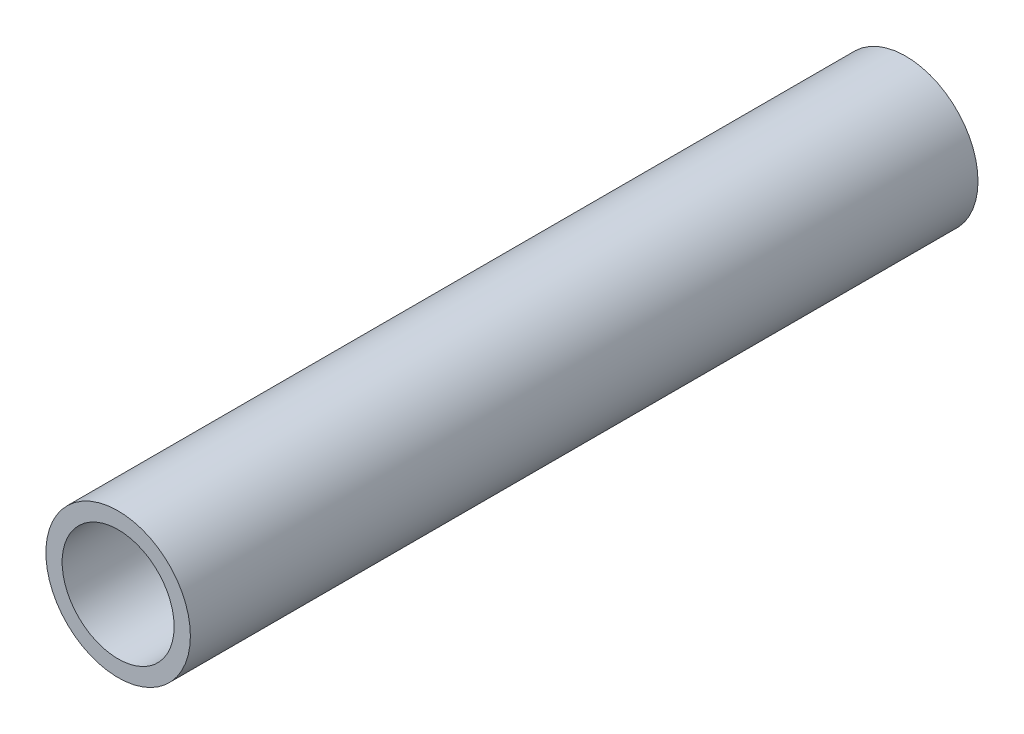
from build123d import *

# Parameters (mm, degrees)
SKETCH_1_R      = 1
SKETCH_1_R_2    = 0.775
EXTRUDE_1_DEPTH = 10.9


with BuildPart() as part:
    # Эскиз1 → Бобышка-Вытянуть1 (new body)
    with BuildSketch(Plane.XY):
        Circle(SKETCH_1_R)
        Circle(SKETCH_1_R_2, mode=Mode.SUBTRACT)
    extrude(amount=EXTRUDE_1_DEPTH)


solid = part.part
